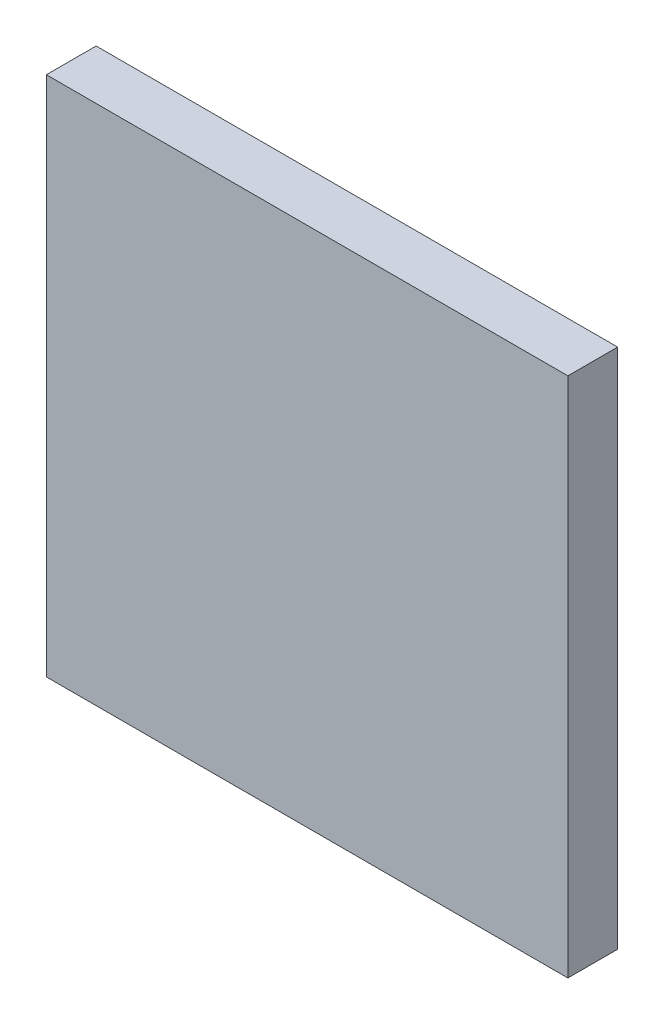
from build123d import *

# Parameters (mm, degrees)
SKETCH1_W      = 35
SKETCH1_H      = 35
EXTRUDE1_DEPTH = 3.34


with BuildPart() as part:
    # Sketch1 → Extrude1 (new body)
    with BuildSketch(Plane.XY):
        with Locations((-25.34, -42.5)):
            Rectangle(SKETCH1_W, SKETCH1_H)
    extrude(amount=EXTRUDE1_DEPTH)


solid = part.part
